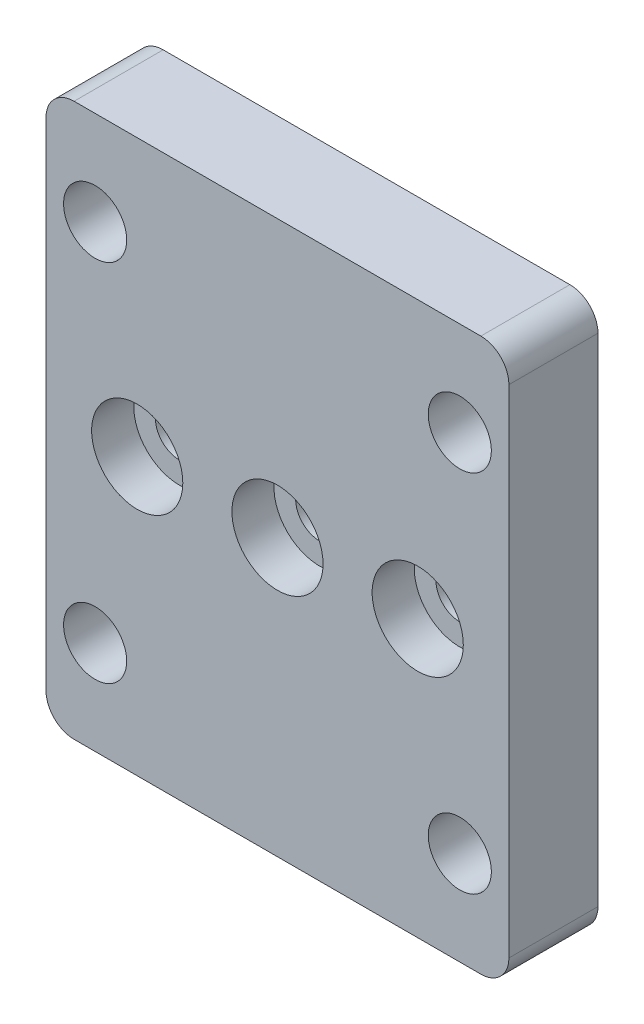
from build123d import *

# Parameters (mm, degrees)
SKETCH1_W                      = 33
SKETCH1_H                      = 39.4
BOSS_EXTRUDE1_DEPTH            = 6.35
CBORE_FOR_M3_SHCS1_D           = 3.4
CBORE_FOR_M3_SHCS1_CBORE_D     = 6.5
CBORE_FOR_M3_SHCS1_CBORE_DEPTH = 3
M4_CLEARANCE_HOLE1_D           = 4.5
FILLET1_R                      = 2


with BuildPart() as part:
    # Sketch1 → Boss-Extrude1 (new body)
    with BuildSketch(Plane.XY):
        Rectangle(SKETCH1_W, SKETCH1_H)
    extrude(amount=BOSS_EXTRUDE1_DEPTH)

    # CBORE for M3 SHCS1 (through all)
    with Locations(Plane.XY.offset(6.35)):
        with Locations((-10, 0), (0, 0), (10, 0)):
            CounterBoreHole(CBORE_FOR_M3_SHCS1_D / 2, CBORE_FOR_M3_SHCS1_CBORE_D / 2, CBORE_FOR_M3_SHCS1_CBORE_DEPTH)

    # M4 Clearance Hole1 (through all)
    with Locations(Plane.XY.offset(6.35)):
        with Locations((-13, 13), (-13, -13), (13, -13), (13, 13)):
            Hole(M4_CLEARANCE_HOLE1_D / 2)

    # Fillet1
    fillet1_edges = [part.edges().sort_by_distance(p)[0] for p in [
        (-16.5, 19.7, 3.175),
        (16.5, 19.7, 3.175),
        (16.5, -19.7, 3.175),
        (-16.5, -19.7, 3.175),
    ]]
    fillet(fillet1_edges, radius=FILLET1_R)


solid = part.part
